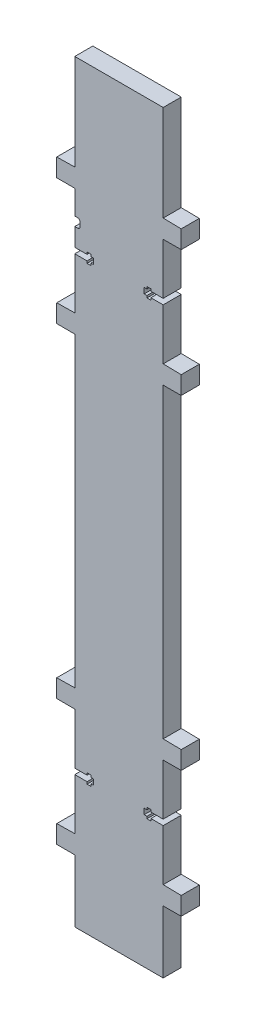
from build123d import *

# Parameters (mm, degrees)
EXTRUDE_1_DEPTH = 10


with BuildPart() as part:
    # Эскиз2 → Бобышка-Вытянуть1 (new body)
    with BuildSketch(Plane.XY):
        with BuildLine():
            Line((-89.227881483, -149.474789065), (-138.227881483, -149.474789065))
            Line((-138.227881483, -149.474789065), (-138.227881483, -114.872465065))
            Line((-138.227881483, -114.872465065), (-148.226492884, -114.839108588))
            Line((-148.226492884, -114.839108588), (-148.226492884, -104.839108588))
            Line((-148.226492884, -104.839108588), (-138.227881483, -104.672465065))
            Line((-138.227881483, -104.672465065), (-138.227881483, -76.322465065))
            Line((-138.227881483, -76.322465065), (-131.427881483, -76.322465065))
            Line((-131.427881483, -76.322465065), (-131.427881483, -77.522465065))
            Line((-131.427881483, -77.522465065), (-129.227881483, -77.522465065))
            Line((-129.227881483, -77.522465065), (-129.227881483, -76.322465065))
            Line((-129.227881483, -76.322465065), (-127.727881483, -76.322465065))
            Line((-127.727881483, -76.322465065), (-127.727881483, -73.222465065))
            Line((-127.727881483, -73.222465065), (-129.227881483, -73.222465065))
            Line((-129.227881483, -73.222465065), (-129.227881483, -72.022465065))
            Line((-129.227881483, -72.022465065), (-131.427881483, -72.022465065))
            Line((-131.427881483, -72.022465065), (-131.427881483, -73.222465065))
            Line((-131.427881483, -73.222465065), (-138.227881483, -73.222465065))
            Line((-138.227881483, -73.222465065), (-138.227881483, -44.872465065))
            Line((-138.227881483, -44.872465065), (-148.226492884, -44.839108588))
            Line((-148.226492884, -44.839108588), (-148.226492884, -34.839108588))
            Line((-148.226492884, -34.839108588), (-138.227881483, -34.672465065))
            Line((-138.227881483, -34.672465065), (-138.227881483, 135.127534935))
            Line((-138.227881483, 135.127534935), (-148.226492884, 135.160891412))
            Line((-148.226492884, 135.160891412), (-148.226492884, 145.160891412))
            Line((-148.226492884, 145.160891412), (-138.227881483, 145.327534935))
            Line((-138.227881483, 145.327534935), (-138.227881483, 173.677534935))
            Line((-138.227881483, 173.677534935), (-131.427881483, 173.677534935))
            Line((-131.427881483, 173.677534935), (-131.427881483, 172.477534935))
            Line((-131.427881483, 172.477534935), (-129.227881483, 172.477534935))
            Line((-129.227881483, 172.477534935), (-129.227881483, 173.677534935))
            Line((-129.227881483, 173.677534935), (-127.727881483, 173.677534935))
            Line((-127.727881483, 173.677534935), (-127.727881483, 176.777534935))
            Line((-127.727881483, 176.777534935), (-129.227881483, 176.777534935))
            Line((-129.227881483, 176.777534935), (-129.227881483, 177.977534935))
            Line((-129.227881483, 177.977534935), (-131.427881483, 177.977534935))
            Line((-131.427881483, 177.977534935), (-131.427881483, 176.777534935))
            Line((-131.427881483, 176.777534935), (-138.227881483, 176.777534935))
            Line((-138.227881483, 176.777534935), (-138.227881483, 186.777534935))
            Line((-138.227881483, 186.777534935), (-136.727881483, 186.777534935))
            ThreePointArc((-136.727881483, 186.777534935), (-135.667221312, 187.216874763), (-135.227881483, 188.277534935))
            Line((-135.227881483, 188.277534935), (-135.227881483, 190.277534935))
            ThreePointArc((-135.227881483, 190.277534935), (-135.667221312, 191.338195107), (-136.727881483, 191.777534935))
            Line((-136.727881483, 191.777534935), (-138.227881483, 191.777534935))
            Line((-138.227881483, 191.777534935), (-138.227881483, 205.127534935))
            Line((-138.227881483, 205.127534935), (-148.226492884, 205.160891412))
            Line((-148.226492884, 205.160891412), (-148.226492884, 215.160891412))
            Line((-148.226492884, 215.160891412), (-138.227881483, 215.327534935))
            Line((-138.227881483, 215.327534935), (-138.227881483, 268.427534935))
            Line((-138.227881483, 268.427534935), (-89.227881483, 268.427534935))
            Line((-89.227881483, 268.427534935), (-89.227881483, 215.327534935))
            Line((-89.227881483, 215.327534935), (-79.229270083, 215.160891412))
            Line((-79.229270083, 215.160891412), (-79.229270083, 205.160891412))
            Line((-79.229270083, 205.160891412), (-89.227881483, 205.127534935))
            Line((-89.227881483, 205.127534935), (-89.227881483, 176.777534935))
            Line((-89.227881483, 176.777534935), (-96.027881483, 176.777534935))
            Line((-96.027881483, 176.777534935), (-96.027881483, 177.977534935))
            Line((-96.027881483, 177.977534935), (-98.227881483, 177.977534935))
            Line((-98.227881483, 177.977534935), (-98.227881483, 176.777534935))
            Line((-98.227881483, 176.777534935), (-99.727881483, 176.777534935))
            Line((-99.727881483, 176.777534935), (-99.727881483, 173.677534935))
            Line((-99.727881483, 173.677534935), (-98.227881483, 173.677534935))
            Line((-98.227881483, 173.677534935), (-98.227881483, 172.477534935))
            Line((-98.227881483, 172.477534935), (-96.027881483, 172.477534935))
            Line((-96.027881483, 172.477534935), (-96.027881483, 173.677534935))
            Line((-96.027881483, 173.677534935), (-89.227881483, 173.677534935))
            Line((-89.227881483, 173.677534935), (-89.227881483, 145.327534935))
            Line((-89.227881483, 145.327534935), (-79.229270083, 145.160891412))
            Line((-79.229270083, 145.160891412), (-79.229270083, 135.160891412))
            Line((-79.229270083, 135.160891412), (-89.227881483, 135.127534935))
            Line((-89.227881483, 135.127534935), (-89.227881483, -34.672465065))
            Line((-89.227881483, -34.672465065), (-79.229270083, -34.839108588))
            Line((-79.229270083, -34.839108588), (-79.229270083, -44.839108588))
            Line((-79.229270083, -44.839108588), (-89.227881483, -44.872465065))
            Line((-89.227881483, -44.872465065), (-89.227881483, -73.222465065))
            Line((-89.227881483, -73.222465065), (-96.027881483, -73.222465065))
            Line((-96.027881483, -73.222465065), (-96.027881483, -72.022465065))
            Line((-96.027881483, -72.022465065), (-98.227881483, -72.022465065))
            Line((-98.227881483, -72.022465065), (-98.227881483, -73.222465065))
            Line((-98.227881483, -73.222465065), (-99.727881483, -73.222465065))
            Line((-99.727881483, -73.222465065), (-99.727881483, -76.322465065))
            Line((-99.727881483, -76.322465065), (-98.227881483, -76.322465065))
            Line((-98.227881483, -76.322465065), (-98.227881483, -77.522465065))
            Line((-98.227881483, -77.522465065), (-96.027881483, -77.522465065))
            Line((-96.027881483, -77.522465065), (-96.027881483, -76.322465065))
            Line((-96.027881483, -76.322465065), (-89.227881483, -76.322465065))
            Line((-89.227881483, -76.322465065), (-89.227881483, -104.672465065))
            Line((-89.227881483, -104.672465065), (-79.229270083, -104.839108588))
            Line((-79.229270083, -104.839108588), (-79.229270083, -114.839108588))
            Line((-79.229270083, -114.839108588), (-89.227881483, -114.872465065))
            Line((-89.227881483, -114.872465065), (-89.227881483, -149.474789065))
        make_face()
    extrude(amount=EXTRUDE_1_DEPTH)


solid = part.part
